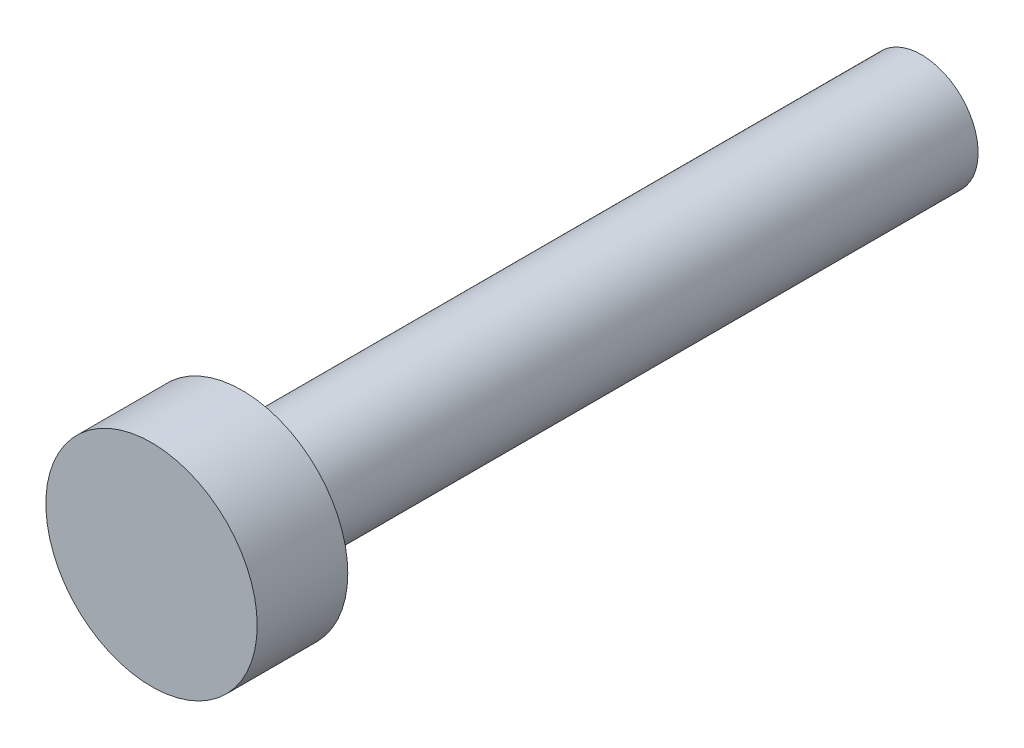
from build123d import *

# Parameters (mm, degrees)
ESQUISSE1_R        = 2.8
BOSS_EXTRU_1_DEPTH = 2.4
ESQUISSE2_R        = 1.5
BOSS_EXTRU_2_DEPTH = 18


with BuildPart() as part:
    # Esquisse1 → Boss.-Extru.1 (new body)
    with BuildSketch(Plane.XY):
        Circle(ESQUISSE1_R)
    extrude(amount=BOSS_EXTRU_1_DEPTH)

    # Esquisse2 → Boss.-Extru.2 (add)
    with BuildSketch(Plane(origin=(0, 0, 0), x_dir=(-1, 0, 0), z_dir=(0, 0, -1))):
        Circle(ESQUISSE2_R)
    extrude(amount=BOSS_EXTRU_2_DEPTH)


solid = part.part
